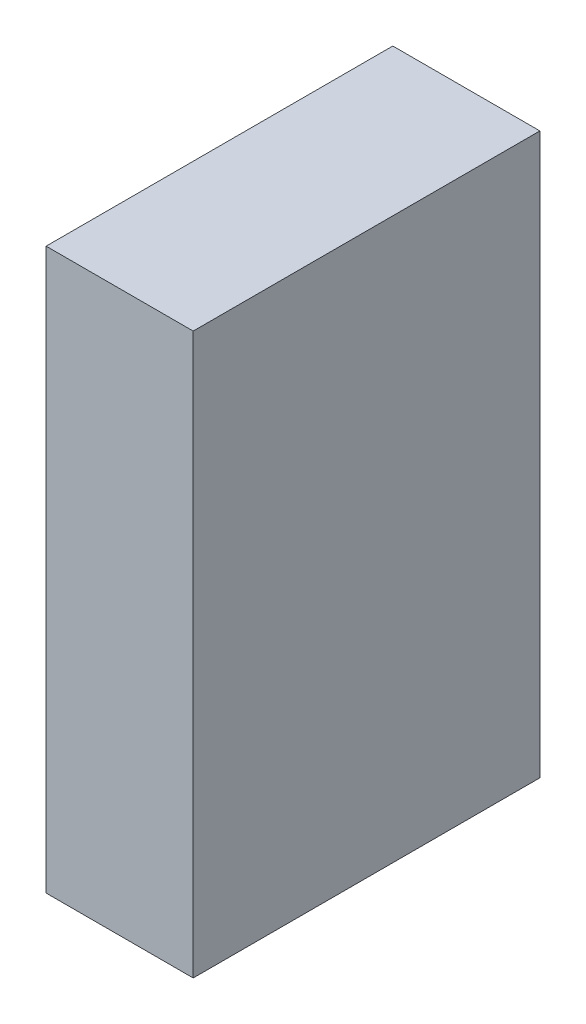
from build123d import *

# Parameters (mm, degrees)
SKETCH1_W           = 42
SKETCH1_H           = 160
BOSS_EXTRUDE1_DEPTH = 99


with BuildPart() as part:
    # Sketch1 → Boss-Extrude1 (new body)
    with BuildSketch(Plane.XY):
        Rectangle(SKETCH1_W, SKETCH1_H)
    extrude(amount=BOSS_EXTRUDE1_DEPTH)


solid = part.part
